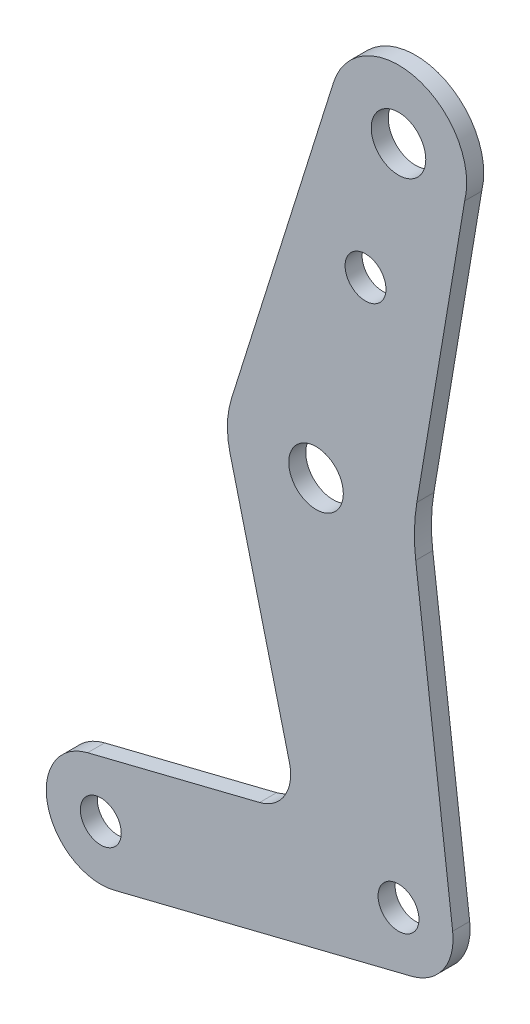
from build123d import *

# Parameters (mm, degrees)
SKETCH1_R           = 3
SKETCH1_R_2         = 4
BOSS_EXTRUDE1_DEPTH = 2.5


with BuildPart() as part:
    # Sketch1 → Boss-Extrude1 (new body)
    with BuildSketch(Plane.XY):
        with BuildLine():
            Line((-1.935375165, 7.76236581), (23.292313718, 14.052335096))
            ThreePointArc((23.292313718, 14.052335096), (26.983786149, 16.783881004), (27.662556702, 21.325640827))
            Line((27.662556702, 21.325640827), (18.953368461, 56.256286973))
            ThreePointArc((18.953368461, 56.256286973), (18.573069496, 59.791447393), (19.164792931, 63.297420849))
            Line((19.164792931, 63.297420849), (34.122984627, 110.913095801))
            ThreePointArc((34.122984627, 110.913095801), (46.372656677, 117.54203466), (53.366264945, 105.496838974))
            Line((53.366264945, 105.496838974), (46.354025639, 63.703511227))
            ThreePointArc((46.354025639, 63.703511227), (46.002134254, 59.983795798), (46.187035414, 56.252050633))
            Line((46.187035414, 56.252050633), (51.60440687, 11.855476374))
            ThreePointArc((51.60440687, 11.855476374), (50.25461519, 6.352759975), (45.598682847, 3.124119492))
            Line((45.598682847, 3.124119492), (1.935375165, -7.76236581))
            ThreePointArc((1.935375165, -7.76236581), (-7.76236581, -1.935375165), (-1.935375165, 7.76236581))
        make_face()
        Circle(SKETCH1_R, mode=Mode.SUBTRACT)
        with Locations((43.663307682, 107.91605793)):
            Circle(SKETCH1_R_2, mode=Mode.SUBTRACT)
        with Locations((31.567212902, 59.401271616)):
            Circle(SKETCH1_R_2, mode=Mode.SUBTRACT)
        with Locations((38.82486977, 88.510143404)):
            Circle(SKETCH1_R, mode=Mode.SUBTRACT)
        with Locations((43.663307682, 10.886485302)):
            Circle(SKETCH1_R, mode=Mode.SUBTRACT)
    extrude(amount=BOSS_EXTRUDE1_DEPTH)


solid = part.part
